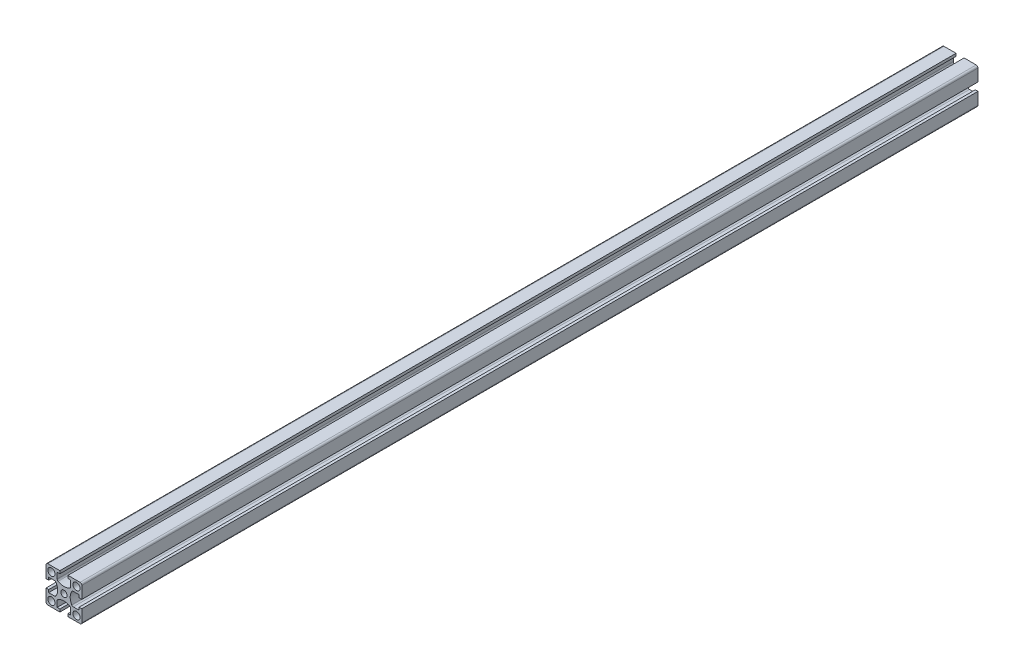
from build123d import *

# Parameters (mm, degrees)
SKETCH1_R           = 4
SKETCH1_R_2         = 3.5
BOSS_EXTRUDE1_DEPTH = 1000


with BuildPart() as part:
    # Sketch1 → Boss-Extrude1 (new body)
    with BuildSketch(Plane.XY):
        with BuildLine():
            Line((-20, 18), (-20, 4.5))
            Line((-20, 4.5), (-17, 4.5))
            Line((-17, 4.5), (-17, 7.5))
            Line((-17, 7.5), (-10.473720558, 7.5))
            ThreePointArc((-10.473720558, 7.5), (-9.473720558, 7.232050808), (-8.741669751, 6.5))
            ThreePointArc((-8.741669751, 6.5), (-7, 0), (-8.741669751, -6.5))
            ThreePointArc((-8.741669751, -6.5), (-9.473720558, -7.232050808), (-10.473720558, -7.5))
            Line((-10.473720558, -7.5), (-17, -7.5))
            Line((-17, -7.5), (-17, -4.5))
            Line((-17, -4.5), (-20, -4.5))
            Line((-20, -4.5), (-20, -18))
            ThreePointArc((-20, -18), (-19.414213562, -19.414213562), (-18, -20))
            Line((-18, -20), (-4.5, -20))
            Line((-4.5, -20), (-4.5, -17))
            Line((-4.5, -17), (-7.5, -17))
            Line((-7.5, -17), (-7.5, -10.473720558))
            ThreePointArc((-7.5, -10.473720558), (-7.232050808, -9.473720558), (-6.5, -8.741669751))
            ThreePointArc((-6.5, -8.741669751), (0, -7), (6.5, -8.741669751))
            ThreePointArc((6.5, -8.741669751), (7.232050808, -9.473720558), (7.5, -10.473720558))
            Line((7.5, -10.473720558), (7.5, -17))
            Line((7.5, -17), (4.5, -17))
            Line((4.5, -17), (4.5, -20))
            Line((4.5, -20), (18, -20))
            ThreePointArc((18, -20), (19.414213562, -19.414213562), (20, -18))
            Line((20, -18), (20, -4.5))
            Line((20, -4.5), (17, -4.5))
            Line((17, -4.5), (17, -7.5))
            Line((17, -7.5), (10.473720558, -7.5))
            ThreePointArc((10.473720558, -7.5), (9.473720558, -7.232050808), (8.741669751, -6.5))
            ThreePointArc((8.741669751, -6.5), (7, 0), (8.741669751, 6.5))
            ThreePointArc((8.741669751, 6.5), (9.473720558, 7.232050808), (10.473720558, 7.5))
            Line((10.473720558, 7.5), (17, 7.5))
            Line((17, 7.5), (17, 4.5))
            Line((17, 4.5), (20, 4.5))
            Line((20, 4.5), (20, 18))
            ThreePointArc((20, 18), (19.414213562, 19.414213562), (18, 20))
            Line((18, 20), (4.5, 20))
            Line((4.5, 20), (4.5, 17))
            Line((4.5, 17), (7.5, 17))
            Line((7.5, 17), (7.5, 10.473720558))
            ThreePointArc((7.5, 10.473720558), (7.232050808, 9.473720558), (6.5, 8.741669751))
            ThreePointArc((6.5, 8.741669751), (0, 7), (-6.5, 8.741669751))
            ThreePointArc((-6.5, 8.741669751), (-7.232050808, 9.473720558), (-7.5, 10.473720558))
            Line((-7.5, 10.473720558), (-7.5, 17))
            Line((-7.5, 17), (-4.5, 17))
            Line((-4.5, 17), (-4.5, 20))
            Line((-4.5, 20), (-18, 20))
            ThreePointArc((-18, 20), (-19.414213562, 19.414213562), (-20, 18))
        make_face()
        with Locations((-14, -14)):
            Circle(SKETCH1_R, mode=Mode.SUBTRACT)
        with Locations((14, -14)):
            Circle(SKETCH1_R, mode=Mode.SUBTRACT)
        with Locations((14, 14)):
            Circle(SKETCH1_R, mode=Mode.SUBTRACT)
        Circle(SKETCH1_R_2, mode=Mode.SUBTRACT)
        with Locations((-14, 14)):
            Circle(SKETCH1_R, mode=Mode.SUBTRACT)
    extrude(amount=BOSS_EXTRUDE1_DEPTH)


solid = part.part
